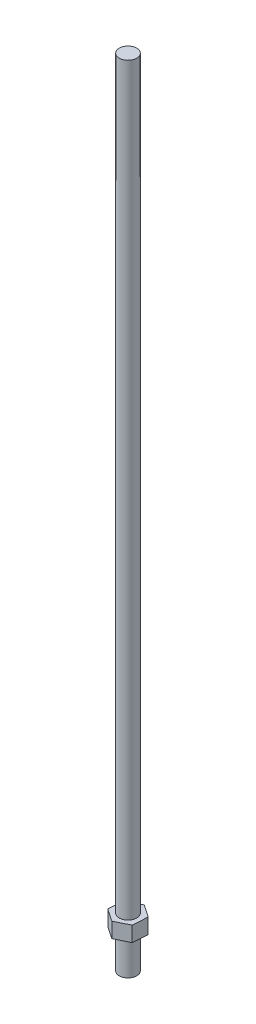
from build123d import *

# Parameters (mm, degrees)
SKETCH1_R           = 6.35
BOSS_EXTRUDE1_DEPTH = 577.85
BOSS_EXTRUDE2_START = 25.4
BOSS_EXTRUDE2_DEPTH = 11.049


with BuildPart() as part:
    # Sketch1 → Boss-Extrude1 (new body)
    with BuildSketch(Plane(origin=(0, 0, 0), x_dir=(1, 0, 0), z_dir=(0, 1, 0))):
        with Locations(Location((0, 0, 0), (0, 0, 270))):
            Circle(SKETCH1_R)
    extrude(amount=BOSS_EXTRUDE1_DEPTH)

    # Sketch3 → Boss-Extrude2 (add)
    with BuildSketch(Plane(origin=(0, 0, 0), x_dir=(1, 0, 0), z_dir=(0, 1, 0)).offset(BOSS_EXTRUDE2_START)):
        Polygon((9.876865428, 4.838907863), (0.747815578, 10.973070302), (-9.129049851, 6.134162439), (-9.876865428, -4.838907863), (-0.747815578, -10.973070302), (9.129049851, -6.134162439), align=None)
    extrude(amount=BOSS_EXTRUDE2_DEPTH)


solid = part.part
